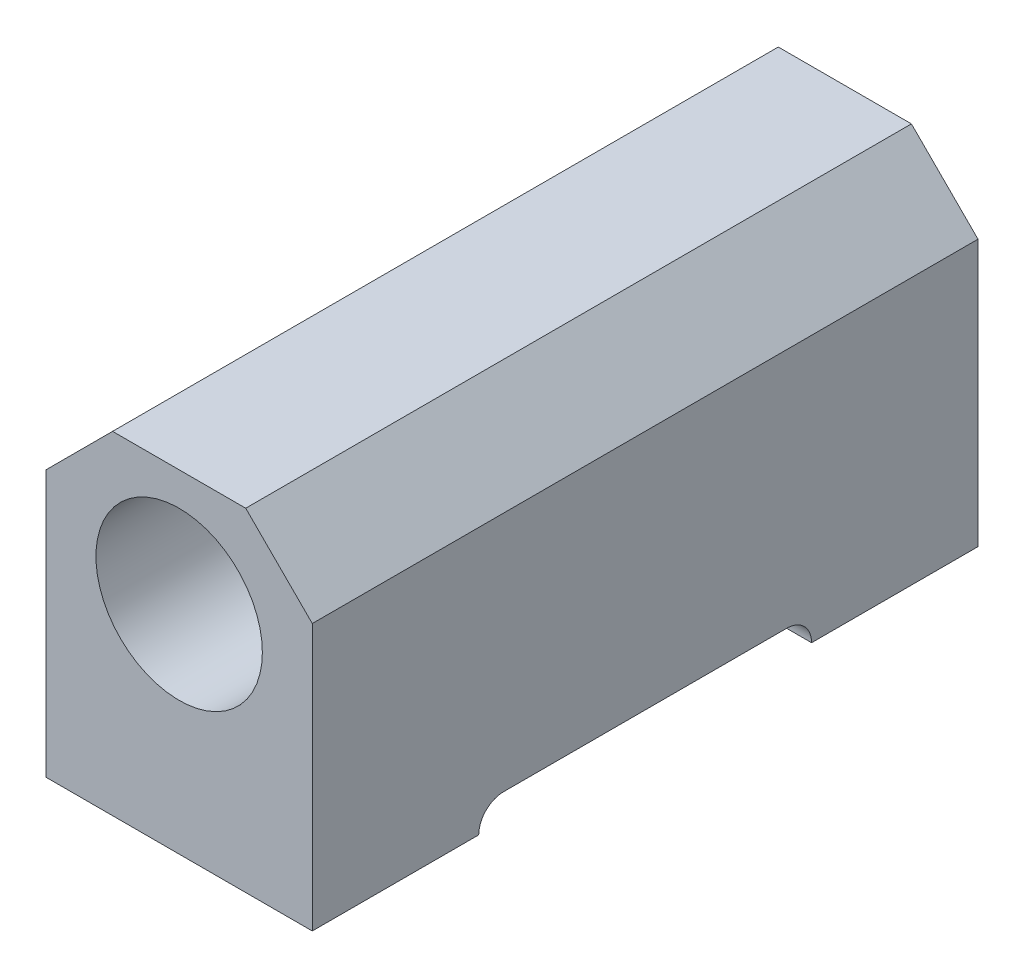
from build123d import *

# Parameters (mm, degrees)
BOSS_EXTRU_1_DEPTH           = 80
ENL_V_MAT_EXTRU_1_DEPTH      = 95.994736696
D_GAGEMENT_M11_D             = 20
D_GAGEMENT_M11_DEPTH         = 72
D_GAGEMENT_M11_TIP           = 5.773502692
ENL_V_MAT_EXTRU_2_REACH      = 91.582
ENL_V_MAT_EXTRU_2_END_RADIUS = 10
ESQUISSE3_R                  = 5
ENL_V_MAT_EXTRU_3_REACH      = 92.863
ENL_V_MAT_EXTRU_3_END_RADIUS = 10
ESQUISSE7_R                  = 2


with BuildPart() as part:
    # Esquisse1 → Boss.-Extru.1 (new body)
    with BuildSketch(Plane.XY):
        Polygon((-16, 0), (16, 0), (16, 32), (8, 40), (-8, 40), (-16, 32), align=None)
    extrude(amount=BOSS_EXTRU_1_DEPTH)

    # Esquisse2 → Enlèv. mat.-Extru.1 (cut, through all)
    with BuildSketch(Plane(origin=(16, 0, 0), x_dir=(0, 0, -1), z_dir=(1, 0, 0))):
        with BuildLine():
            Line((-60, -3), (-60, 0))
            ThreePointArc((-60, 0), (-59.121320344, 2.121320344), (-57, 3))
            Line((-57, 3), (-23, 3))
            ThreePointArc((-23, 3), (-20.878679656, 2.121320344), (-20, 0))
            Line((-20, 0), (-20, -3))
            Line((-20, -3), (-60, -3))
        make_face()
    extrude(amount=-ENL_V_MAT_EXTRU_1_DEPTH, mode=Mode.SUBTRACT)

    # Dégagement M11
    with Locations(Plane.XY.offset(80)):
        with Locations((0, 26)):
            Hole(D_GAGEMENT_M11_D / 2, depth=D_GAGEMENT_M11_DEPTH)
            with Locations((0, 0, -(D_GAGEMENT_M11_DEPTH + D_GAGEMENT_M11_TIP / 2))):  # 120° drill point
                Cone(0, D_GAGEMENT_M11_D / 2, D_GAGEMENT_M11_TIP, mode=Mode.SUBTRACT)

    # Enlèv. mat.-Extru.2: up to this cylinder (the profile starts outside it)
    enl_v_mat_extru_2_end = Plane(origin=(0, 26, 40), z_dir=(0, 0, 1)) * Cylinder(ENL_V_MAT_EXTRU_2_END_RADIUS, 204.164, mode=Mode.PRIVATE)
    # Esquisse3 → Enlèv. mat.-Extru.2 (cut, up to the surface)
    with BuildSketch(Plane.XZ.offset(-3), mode=Mode.PRIVATE) as enl_v_mat_extru_2_sk1:
        with Locations(Location((0, 40, 0), (0, 0, 270))):
            Circle(ESQUISSE3_R)
    enl_v_mat_extru_2_tool1 = extrude(enl_v_mat_extru_2_sk1.sketch, amount=-ENL_V_MAT_EXTRU_2_REACH, mode=Mode.PRIVATE) - enl_v_mat_extru_2_end
    add(enl_v_mat_extru_2_tool1.solids().sort_by_distance((0, 3, 40))[0], mode=Mode.SUBTRACT)

    # Enlèv. mat.-Extru.3: up to this cylinder (the profile starts outside it)
    enl_v_mat_extru_3_end = Plane(origin=(0, 26, 10), z_dir=(0, 0, 1)) * Cylinder(ENL_V_MAT_EXTRU_3_END_RADIUS, 206.726, mode=Mode.PRIVATE)
    # Esquisse7 → Enlèv. mat.-Extru.3 (cut, up to the surface)
    with BuildSketch(Plane.XZ, mode=Mode.PRIVATE) as enl_v_mat_extru_3_sk1:
        with Locations(Location((0, 10, 0), (0, 0, 270))):
            Circle(ESQUISSE7_R)
    enl_v_mat_extru_3_tool1 = extrude(enl_v_mat_extru_3_sk1.sketch, amount=-ENL_V_MAT_EXTRU_3_REACH, mode=Mode.PRIVATE) - enl_v_mat_extru_3_end
    add(enl_v_mat_extru_3_tool1.solids().sort_by_distance((0, 0, 10))[0], mode=Mode.SUBTRACT)


solid = part.part
